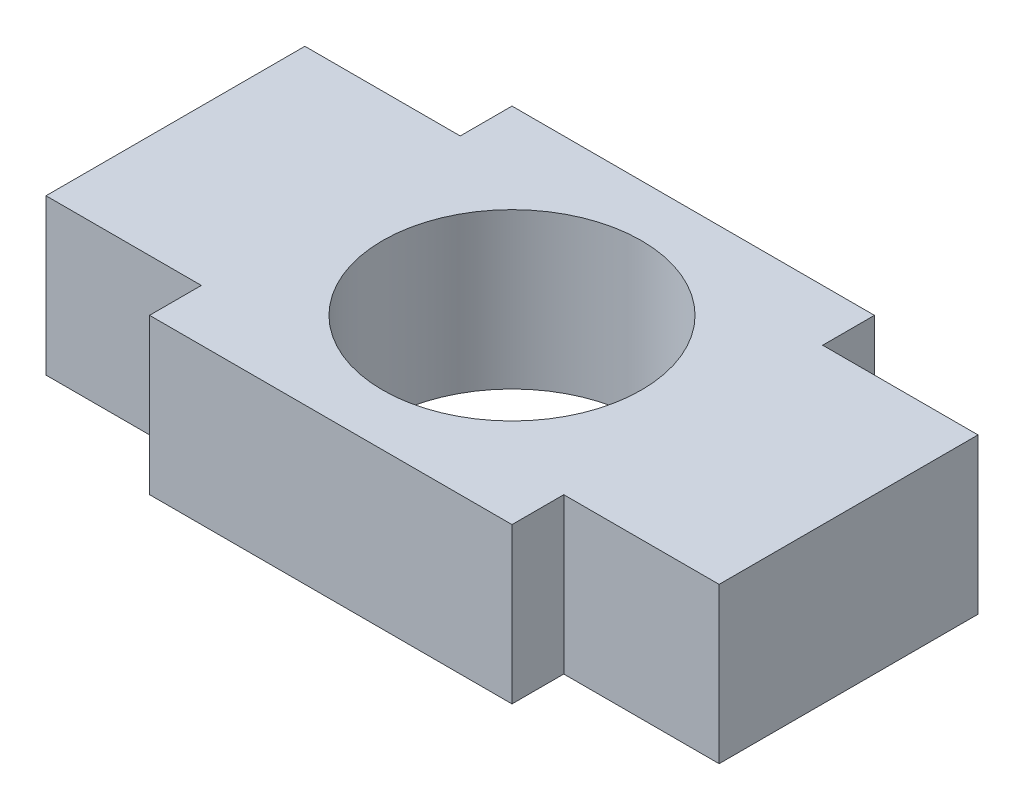
from build123d import *

# Parameters (mm, degrees)
SKETCH1_W           = 7
SKETCH1_H           = 7
BOSS_EXTRUDE1_DEPTH = 3
SKETCH2_R           = 2.5
CUT_EXTRUDE1_DEPTH  = 3
SKETCH4_W           = 3
SKETCH4_H           = 5
BOSS_EXTRUDE2_DEPTH = 3


with BuildPart() as part:
    # Sketch1 → Boss-Extrude1 (new body)
    with BuildSketch(Plane(origin=(0, 0, 0), x_dir=(1, 0, 0), z_dir=(0, 1, 0))):
        Rectangle(SKETCH1_W, SKETCH1_H)
    extrude(amount=BOSS_EXTRUDE1_DEPTH)

    # Sketch2 → Cut-Extrude1 (cut)
    with BuildSketch(Plane(origin=(0, 3, 0), x_dir=(1, 0, 0), z_dir=(0, 1, 0))):
        with Locations(Location((0, 0, 0), (0, 0, 270))):
            Circle(SKETCH2_R)
    extrude(amount=-CUT_EXTRUDE1_DEPTH, mode=Mode.SUBTRACT)

    # Sketch4 → Boss-Extrude2 (add)
    with BuildSketch(Plane(origin=(0, 3, 0), x_dir=(1, 0, 0), z_dir=(0, 1, 0))):
        with Locations((-5, 0)):
            Rectangle(SKETCH4_W, SKETCH4_H)
        with Locations((5, 0)):
            Rectangle(SKETCH4_W, SKETCH4_H)
    extrude(amount=-BOSS_EXTRUDE2_DEPTH)


solid = part.part
